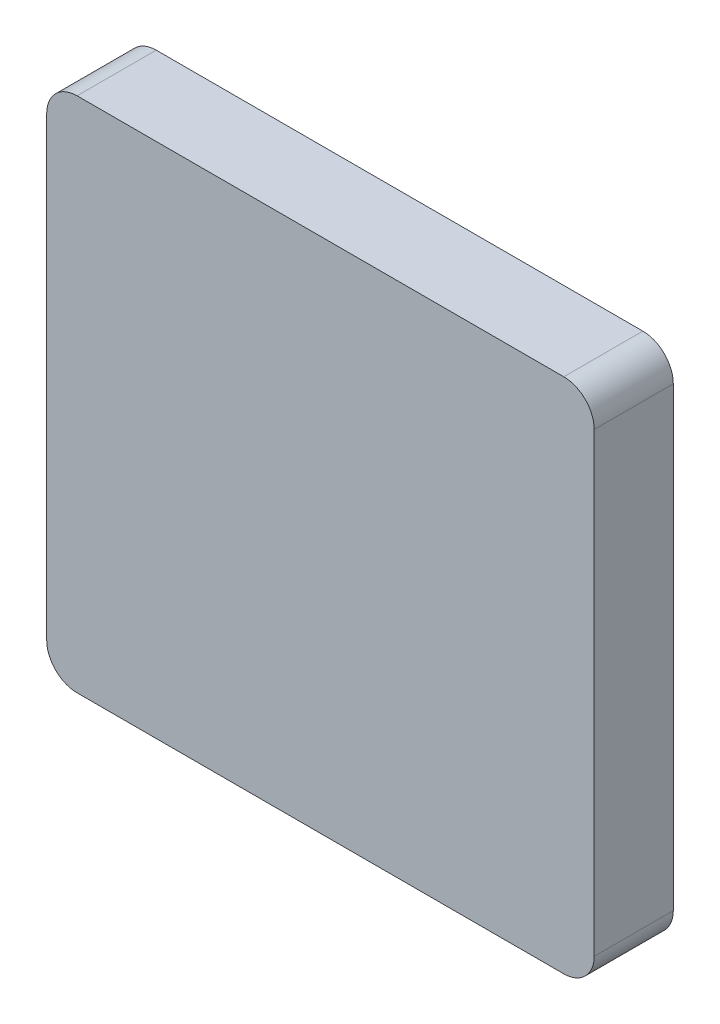
from build123d import *

# Parameters (mm, degrees)
SKETCH_1_W      = 18
SKETCH_1_H      = 17
EXTRUDE_1_DEPTH = 2.6
FILLET_2_R      = 1


with BuildPart() as part:
    # ｽｹｯﾁ1 → ﾎﾞｽ - 押し出し1 (new body)
    with BuildSketch(Plane.XY):
        Rectangle(SKETCH_1_W, SKETCH_1_H)
    extrude(amount=EXTRUDE_1_DEPTH)

    # ﾌｨﾚｯﾄ2
    fillet_2_edges = [part.edges().sort_by_distance(p)[0] for p in [
        (-9, 8.5, 1.3),
        (9, 8.5, 1.3),
        (9, -8.5, 1.3),
        (-9, -8.5, 1.3),
    ]]
    fillet(fillet_2_edges, radius=FILLET_2_R)


solid = part.part
